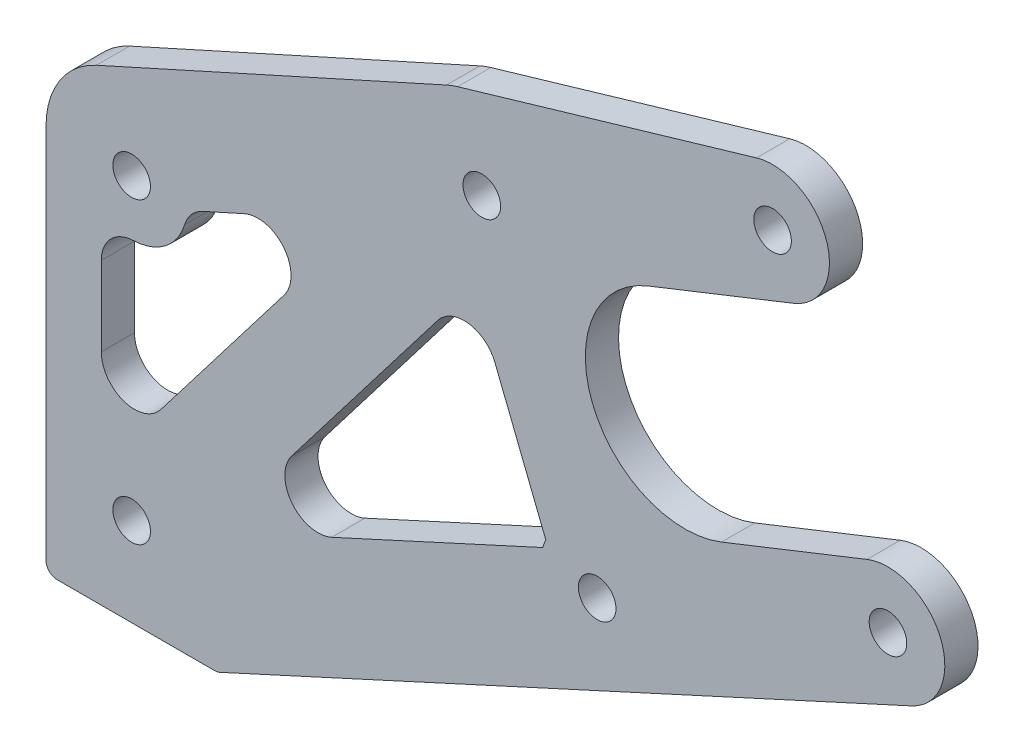
from build123d import *

# Parameters (mm, degrees)
BOSS_EXTRUDE1_DEPTH  = 3
M3_CLEARANCE_HOLE1_D = 3.4
FILLET1_R            = 1
CUT_EXTRUDE1_DEPTH   = 93.987352344
FILLET2_R            = 3


with BuildPart() as part:
    # Sketch1 → Boss-Extrude1 (new body)
    with BuildSketch(Plane.XY):
        with BuildLine():
            Line((-7.745, -8), (7.745, -8))
            Line((7.745, -8), (70.519857407, 20.746231418))
            ThreePointArc((70.519857407, 20.746231418), (73.107899278, 27.441010115), (66.482157687, 30.201004841))
            Line((66.482157687, 30.201004841), (53.337310845, 24.984396605))
            ThreePointArc((53.337310845, 24.984396605), (41.652152386, 30.029896758), (46.697652539, 41.715055217))
            Line((46.697652539, 41.715055217), (59.842499382, 46.931663453))
            ThreePointArc((59.842499382, 46.931663453), (62.807533315, 53.385795263), (56.49682568, 56.644968901))
            Line((56.49682568, 56.644968901), (29.473725399, 48.709154624))
            ThreePointArc((29.473725399, 48.709154624), (28.966294631, 48.540909296), (28.471678813, 48.338060414))
            Line((28.471678813, 48.338060414), (-3.1843478, 34.060095898))
            ThreePointArc((-3.1843478, 34.060095898), (-6.505682082, 31.202514205), (-7.745, 27))
            Line((-7.745, 27), (-7.745, -8))
        make_face()
    extrude(amount=BOSS_EXTRUDE1_DEPTH)

    # M3 Clearance Hole1 (through all)
    with Locations(Plane(origin=(0, 0, 0), x_dir=(1, 0, 0), z_dir=(0, 0, -1))):
        with Locations((57.945720298, -51.711180989), (68.378936771, -25.421487305), (42.089243086, -14.988270832), (31.656026613, -41.277964517), (0, -27), (0, 0)):
            Hole(M3_CLEARANCE_HOLE1_D / 2)

    # Fillet1
    fillet1_edges = [part.edges().sort_by_distance(p)[0] for p in [
        (7.745, -8, 1.5),
        (-7.745, -8, 1.5),
    ]]
    fillet(fillet1_edges, radius=FILLET1_R)

    # Sketch4 → Cut-Extrude1 (cut, through all)
    with BuildSketch(Plane(origin=(0, 0, 0), x_dir=(-1, 0, 0), z_dir=(0, 0, -1))):
        with BuildLine():
            ThreePointArc((-37.446464364, 17.198737867), (-37.2921785, 16.840223889), (-37.165529718, 16.471040349))
            Line((-37.165529718, 16.471040349), (-7.121534424, 2.713117557))
            Line((-7.121534424, 2.713117557), (-30.893579986, 33.710742913))
            Line((-30.893579986, 33.710742913), (-37.446464364, 17.198737867))
        make_face()
        with BuildLine():
            Line((-21.049163615, 34.020143008), (2.745, 2.993676756))
            Line((2.745, 2.993676756), (2.745, 22.820888252))
            ThreePointArc((2.745, 22.820888252), (-2.276587416, 22.548354266), (-4.995123002, 26.779214606))
            Line((-4.995123002, 26.779214606), (-21.049163615, 34.020143008))
        make_face()
    extrude(amount=-CUT_EXTRUDE1_DEPTH, mode=Mode.SUBTRACT)

    # Fillet2
    fillet2_edges = [part.edges().sort_by_distance(p)[0] for p in [
        (30.893579986, 33.710742913, 1.5),
        (7.121534424, 2.713117557, 1.5),
        (-2.745, 22.820888252, 1.5),
        (-2.745, 2.993676756, 1.5),
        (21.049163615, 34.020143008, 1.5),
        (4.995123002, 26.779214606, 1.5),
    ]]
    fillet(fillet2_edges, radius=FILLET2_R)


solid = part.part
